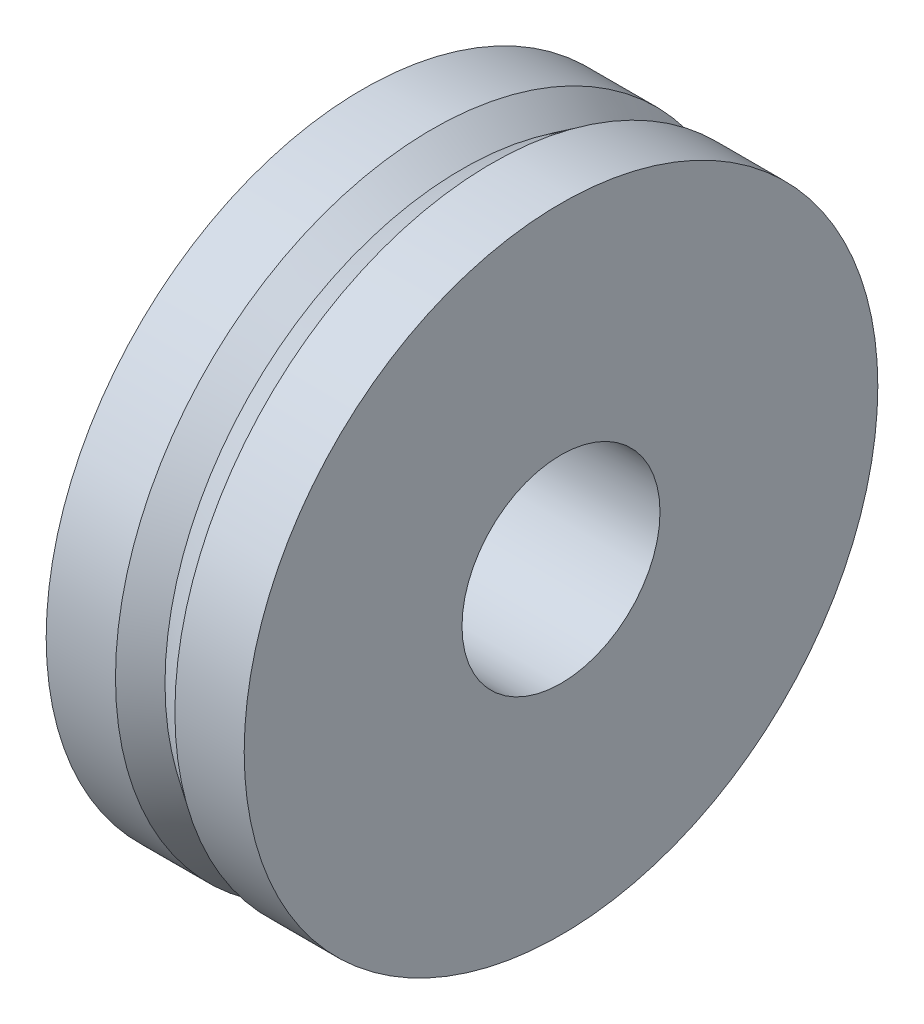
from build123d import *

# Parameters (mm, degrees)
SKETCH1_R           = 8
SKETCH1_R_2         = 2.5
BOSS_EXTRUDE1_DEPTH = 5


with BuildPart() as part:
    # Sketch1 → Boss-Extrude1 (new body)
    with BuildSketch(Plane(origin=(0, 0, 0), x_dir=(0, 0, -1), z_dir=(1, 0, 0))):
        Circle(SKETCH1_R)
        Circle(SKETCH1_R_2, mode=Mode.SUBTRACT)
    extrude(amount=BOSS_EXTRUDE1_DEPTH)

    # Sketch2 → Cut-Revolve1 (revolve, cut)
    with BuildSketch(Plane(origin=(0, 0, 0), x_dir=(1, 0, 0), z_dir=(0, 1, 0)), mode=Mode.PRIVATE) as cut_revolve1_sk:
        Polygon((1.75, 8), (2.5, 7.5), (3.25, 8), align=None)
    revolve(cut_revolve1_sk.sketch.rotate(Axis((0, 0, 0), (1, 0, 0)), 180), axis=Axis((0, 0, 0), (1, 0, 0)), mode=Mode.SUBTRACT)


solid = part.part
